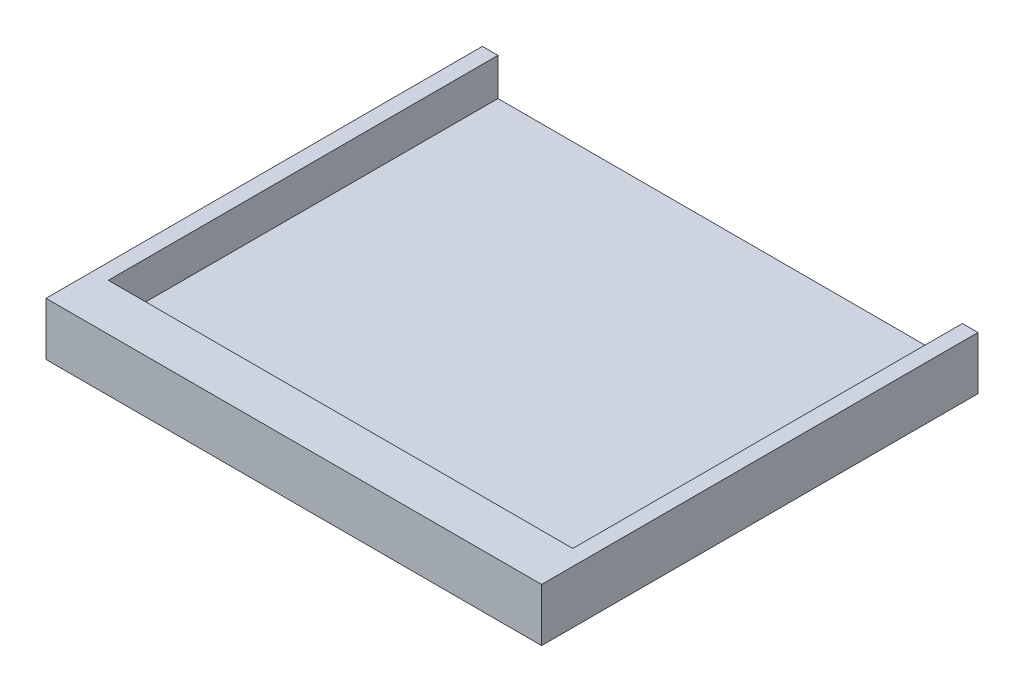
from build123d import *

# Parameters (mm, degrees)
SKETCH1_W           = 29.8
SKETCH1_H           = 27
BOSS_EXTRUDE1_DEPTH = 1
BOSS_EXTRUDE2_DEPTH = 2.4
SKETCH3_W           = 31.8
SKETCH3_H           = 3
BOSS_EXTRUDE3_DEPTH = 1
SKETCH5_W           = 1
SKETCH5_H           = 25
BOSS_EXTRUDE4_DEPTH = 1
SKETCH6_W           = 1
SKETCH6_H           = 25
BOSS_EXTRUDE5_DEPTH = 1


with BuildPart() as part:
    # Sketch1 → Boss-Extrude1 (new body)
    with BuildSketch(Plane(origin=(0, 0, 0), x_dir=(1, 0, 0), z_dir=(0, 1, 0))):
        Rectangle(SKETCH1_W, SKETCH1_H)
    extrude(amount=BOSS_EXTRUDE1_DEPTH)

    # Sketch2 → Boss-Extrude2 (add)
    with BuildSketch(Plane.XZ):
        Polygon((15.9, -13.5), (15.9, 14.5), (-15.9, 14.5), (-15.9, -13.5), (-14.9, -13.5), (-14.9, 13.5), (14.9, 13.5), (14.9, -13.5), align=None)
    extrude(amount=-BOSS_EXTRUDE2_DEPTH)

    # Sketch3 → Boss-Extrude3 (add)
    with BuildSketch(Plane(origin=(0, 2.4, 0), x_dir=(1, 0, 0), z_dir=(0, 1, 0))):
        with Locations((0, -13)):
            Rectangle(SKETCH3_W, SKETCH3_H)
    extrude(amount=BOSS_EXTRUDE3_DEPTH)

    # Sketch5 → Boss-Extrude4 (add)
    with BuildSketch(Plane(origin=(0, 2.4, 0), x_dir=(1, 0, 0), z_dir=(0, 1, 0))):
        with Locations((15.4, 1)):
            Rectangle(SKETCH5_W, SKETCH5_H)
    extrude(amount=BOSS_EXTRUDE4_DEPTH)

    # Sketch6 → Boss-Extrude5 (add)
    with BuildSketch(Plane(origin=(0, 2.4, 0), x_dir=(1, 0, 0), z_dir=(0, 1, 0))):
        with Locations((-15.4, 1)):
            Rectangle(SKETCH6_W, SKETCH6_H)
    extrude(amount=BOSS_EXTRUDE5_DEPTH)


solid = part.part
